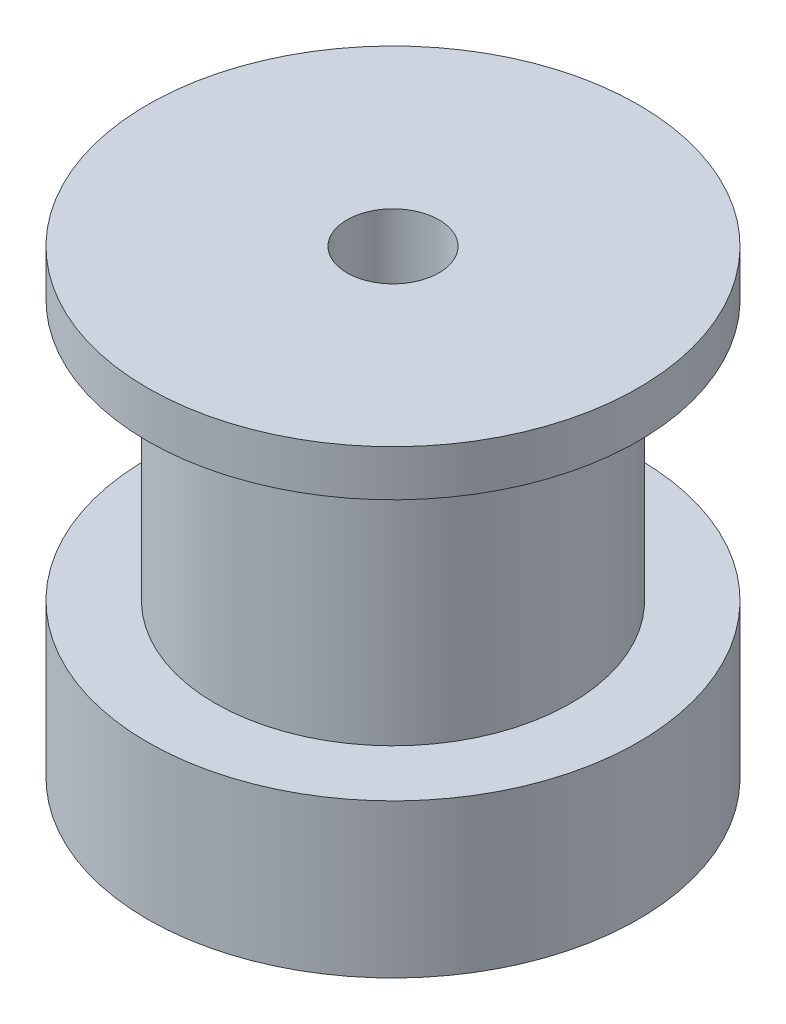
from build123d import *

# Parameters (mm, degrees)
SKETCH1_R           = 8
BOSS_EXTRUDE1_DEPTH = 5
SKETCH2_R           = 5.8
BOSS_EXTRUDE2_DEPTH = 8.5
SKETCH3_R           = 8
BOSS_EXTRUDE3_DEPTH = 1.5
SKETCH4_R           = 1.5
CUT_EXTRUDE1_DEPTH  = 15


with BuildPart() as part:
    # Sketch1 → Boss-Extrude1 (new body)
    with BuildSketch(Plane(origin=(0, 0, 0), x_dir=(1, 0, 0), z_dir=(0, 1, 0))):
        with Locations(Location((0, 0, 0), (0, 0, 270))):
            Circle(SKETCH1_R)
    extrude(amount=BOSS_EXTRUDE1_DEPTH)

    # Sketch2 → Boss-Extrude2 (add)
    with BuildSketch(Plane(origin=(0, 5, 0), x_dir=(1, 0, 0), z_dir=(0, 1, 0))):
        with Locations(Location((0, 0, 0), (0, 0, 270))):
            Circle(SKETCH2_R)
    extrude(amount=BOSS_EXTRUDE2_DEPTH)

    # Sketch3 → Boss-Extrude3 (add)
    with BuildSketch(Plane(origin=(0, 13.5, 0), x_dir=(1, 0, 0), z_dir=(0, 1, 0))):
        with Locations(Location((0, 0, 0), (0, 0, 270))):
            Circle(SKETCH3_R)
    extrude(amount=BOSS_EXTRUDE3_DEPTH)

    # Sketch4 → Cut-Extrude1 (cut)
    with BuildSketch(Plane(origin=(0, 15, 0), x_dir=(1, 0, 0), z_dir=(0, 1, 0))):
        with Locations(Location((0, 0, 0), (0, 0, 270))):
            Circle(SKETCH4_R)
    extrude(amount=-CUT_EXTRUDE1_DEPTH, mode=Mode.SUBTRACT)


solid = part.part
